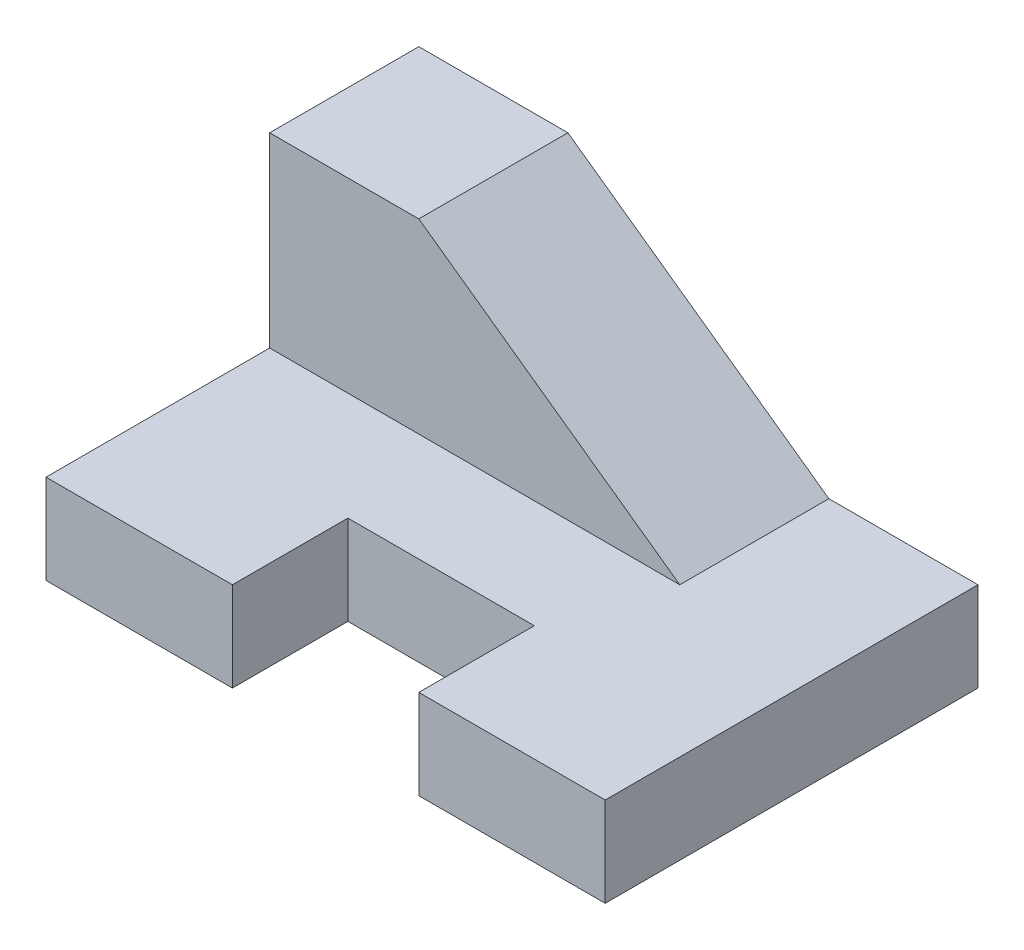
from build123d import *

# Parameters (mm, degrees)
BOSS_EXTRUDE1_DEPTH = 12
BOSS_EXTRUDE4_DEPTH = 20


with BuildPart() as part:
    # Sketch2 → Boss-Extrude1 (new body)
    with BuildSketch(Plane(origin=(0, 0, 0), x_dir=(1, 0, 0), z_dir=(0, 1, 0))):
        Polygon((-37.5, 25), (37.5, 25), (37.5, -25), (12.5, -25), (12.5, -9.510869565), (-12.5, -9.510869565), (-12.5, -25), (-37.5, -25), align=None)
    extrude(amount=BOSS_EXTRUDE1_DEPTH)

    # Sketch4 → Boss-Extrude4 (add)
    with BuildSketch(Plane(origin=(0, 0, -25), x_dir=(-1, 0, 0), z_dir=(0, 0, -1))):
        Polygon((37.5, 12), (37.5, 37), (17.5, 37), (-17.5, 12), align=None)
    extrude(amount=-BOSS_EXTRUDE4_DEPTH)


solid = part.part
